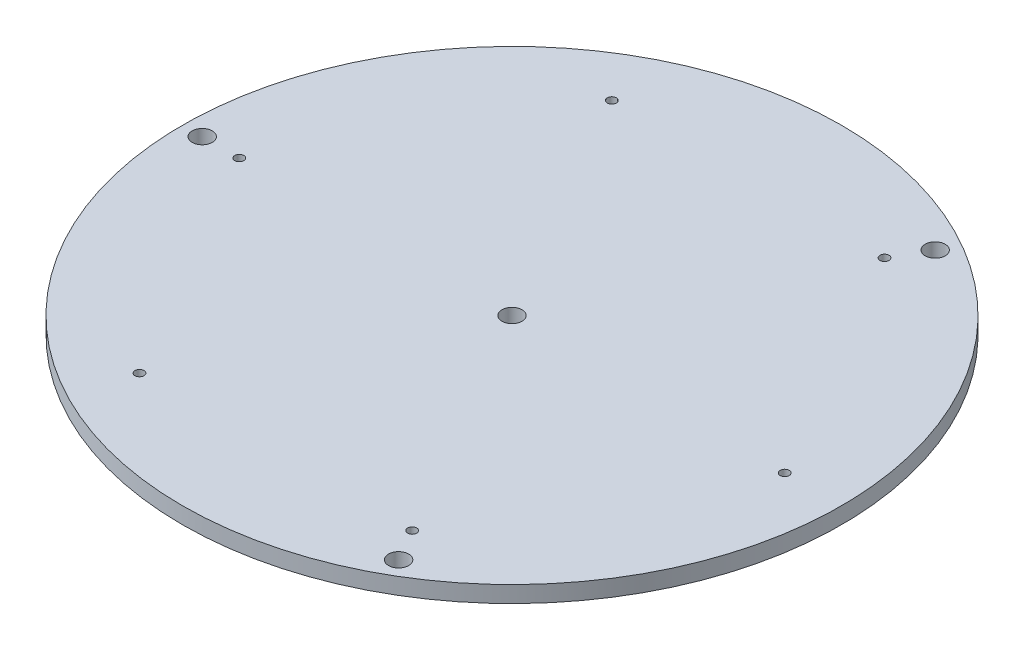
from build123d import *

# Parameters (mm, degrees)
SKETCH_1_R               = 200
SKETCH_1_R_2             = 6.1
EXTRUDE_1_DEPTH          = 10
SKETCH_2_R               = 6.1
CUT_EXTRUDE_1_DEPTH      = 10
PATTERN_CIRCULAR_1_COUNT = 3
SKETCH_3_R               = 2.75
CUT_EXTRUDE_2_DEPTH      = 10
PATTERN_CIRCULAR_2_COUNT = 6


with BuildPart() as part:
    # Эскиз1 → Бобышка-Вытянуть1 (new body)
    with BuildSketch(Plane(origin=(0, 0, 0), x_dir=(1, 0, 0), z_dir=(0, 1, 0))):
        with Locations(Location((0, 0, 0), (0, 0, 270))):
            Circle(SKETCH_1_R)
        with Locations(Location((0, 0, 0), (0, 0, 270))):
            Circle(SKETCH_1_R_2, mode=Mode.SUBTRACT)
    extrude(amount=EXTRUDE_1_DEPTH)

    # Эскиз2 → Вырез-Вытянуть1 (cut)
    with BuildSketch(Plane(origin=(0, 10, 0), x_dir=(1, 0, 0), z_dir=(0, 1, 0))):
        with Locations(Location((-188, 0, 0), (0, 0, 270))):
            Circle(SKETCH_2_R)
    cut_extrude_1 = extrude(amount=-CUT_EXTRUDE_1_DEPTH, mode=Mode.SUBTRACT)

    # Круговой массив1: Вырез-Вытянуть1 ×3 about axis
    pattern_circular_1_axis = Axis((0, 0, 0), (0, 1, 0))
    for i in range(1, PATTERN_CIRCULAR_1_COUNT):
        add(cut_extrude_1.rotate(pattern_circular_1_axis, i * 360 / PATTERN_CIRCULAR_1_COUNT), mode=Mode.SUBTRACT)

    # Эскиз3 → Вырез-Вытянуть2 (cut)
    with BuildSketch(Plane(origin=(0, 10, 0), x_dir=(1, 0, 0), z_dir=(0, 1, 0))):
        with Locations(Location((-165.5, 0, 0), (0, 0, 270))):
            Circle(SKETCH_3_R)
    cut_extrude_2 = extrude(amount=-CUT_EXTRUDE_2_DEPTH, mode=Mode.SUBTRACT)

    # Круговой массив2: Вырез-Вытянуть2 ×6 about axis
    pattern_circular_2_axis = Axis((0, 0, 0), (0, 1, 0))
    for i in range(1, PATTERN_CIRCULAR_2_COUNT):
        add(cut_extrude_2.rotate(pattern_circular_2_axis, i * 360 / PATTERN_CIRCULAR_2_COUNT), mode=Mode.SUBTRACT)


solid = part.part
